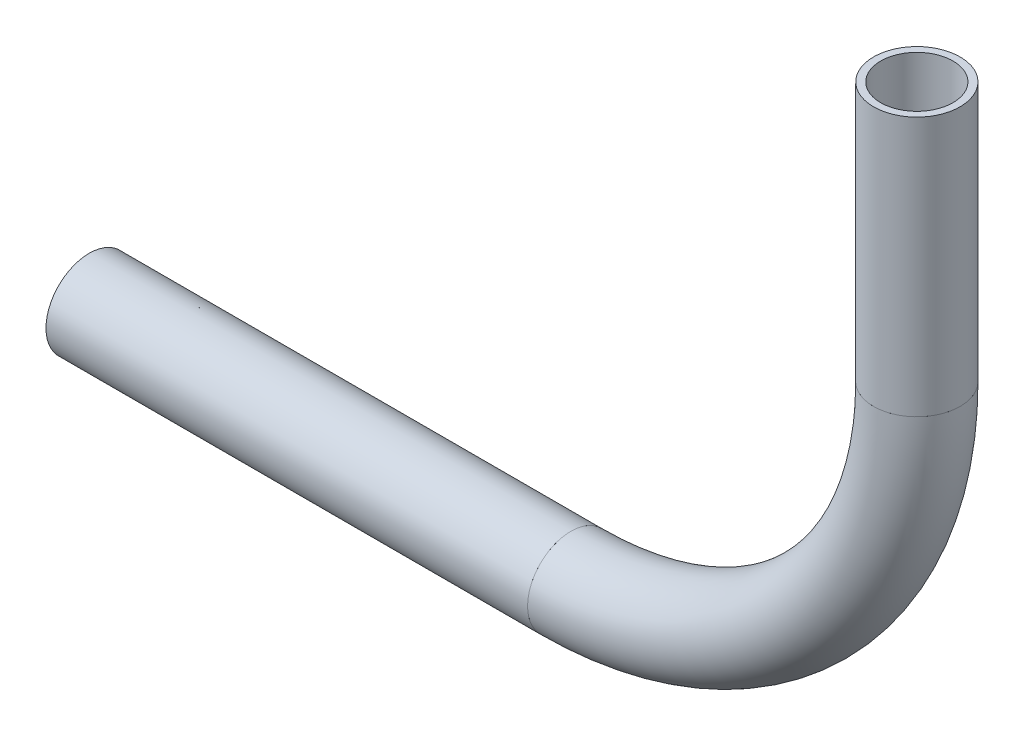
from build123d import *

# Parameters (mm, degrees)
SKETCH1_R                 = 6.35
SKETCH1_R_2               = 5.3086
PIPE_0_5_SCH_40_1_DEPTH   = 38.1
SKETCH1_ON_SEGMENT_2_R    = 6.35
SKETCH1_ON_SEGMENT_2_R_2  = 5.3086
PIPE_0_5_SCH_40_1_2_ANGLE = 90
SKETCH1_ON_SEGMENT_3_R    = 6.35
SKETCH1_ON_SEGMENT_3_R_2  = 5.3086
PIPE_0_5_SCH_40_1_3_DEPTH = 70.710462117


with BuildPart() as part:
    # Sketch1 → Pipe 0.5 SCH 40(1) (new body)
    with BuildSketch(Plane(origin=(-669.026852299, -826.74293683, 0), x_dir=(1, 0, 0), z_dir=(0, -1, 0))):
        Circle(SKETCH1_R)
        Circle(SKETCH1_R_2, mode=Mode.SUBTRACT)
    extrude(amount=-PIPE_0_5_SCH_40_1_DEPTH)


with BuildPart() as body_2:
    # Sketch1 on segment 2 (carried to the start of arc 2) → Pipe 0.5 SCH 40_1 2 (revolve)
    with BuildSketch(Plane(origin=(-669.026852299, -826.74293683, 0), x_dir=(1, 0, 0), z_dir=(0, -1, 0))):
        Circle(SKETCH1_ON_SEGMENT_2_R)
        Circle(SKETCH1_ON_SEGMENT_2_R_2, mode=Mode.SUBTRACT)
    revolve(axis=Axis((-719.826852299, -826.74293683, 0), (0, 0, -1)), revolution_arc=PIPE_0_5_SCH_40_1_2_ANGLE)


with BuildPart() as body_3:
    # Sketch1 on segment 3 (carried to segment 3) → Pipe 0.5 SCH 40_1 3 (new body)
    with BuildSketch(Plane(origin=(-719.826852299, -877.54293683, 0), x_dir=(0, -1, 0), z_dir=(-1, 0, 0))):
        Circle(SKETCH1_ON_SEGMENT_3_R)
        Circle(SKETCH1_ON_SEGMENT_3_R_2, mode=Mode.SUBTRACT)
    extrude(amount=PIPE_0_5_SCH_40_1_3_DEPTH)


solid = Compound([part.part, body_2.part, body_3.part])
